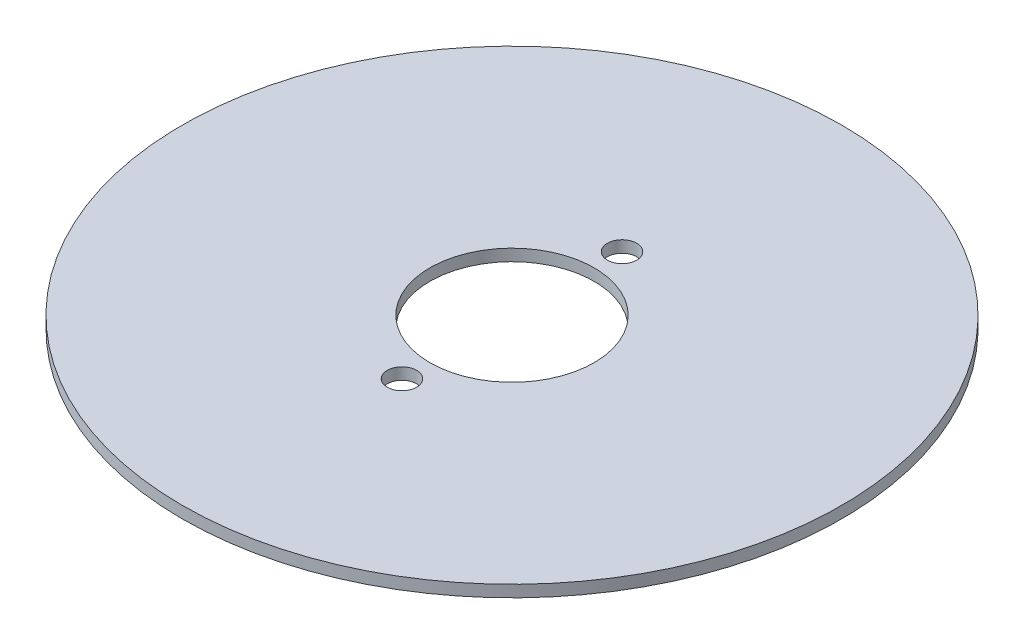
from build123d import *

# Parameters (mm, degrees)
SKETCH1_R           = 56.15
SKETCH1_R_2         = 2.5
SKETCH1_R_3         = 14
BOSS_EXTRUDE1_DEPTH = 2


with BuildPart() as part:
    # Sketch1 → Boss-Extrude1 (new body)
    with BuildSketch(Plane(origin=(0, 0, 0), x_dir=(1, 0, 0), z_dir=(0, 1, 0))):
        with Locations(Location((0, 0, 0), (0, 0, 270))):
            Circle(SKETCH1_R)
        with Locations(Location((0, 18.75, 0), (0, 0, 270))):
            Circle(SKETCH1_R_2, mode=Mode.SUBTRACT)
        with Locations(Location((0, -18.75, 0), (0, 0, 270))):
            Circle(SKETCH1_R_2, mode=Mode.SUBTRACT)
        with Locations(Location((0, 0, 0), (0, 0, 270))):
            Circle(SKETCH1_R_3, mode=Mode.SUBTRACT)
    extrude(amount=BOSS_EXTRUDE1_DEPTH)


solid = part.part
